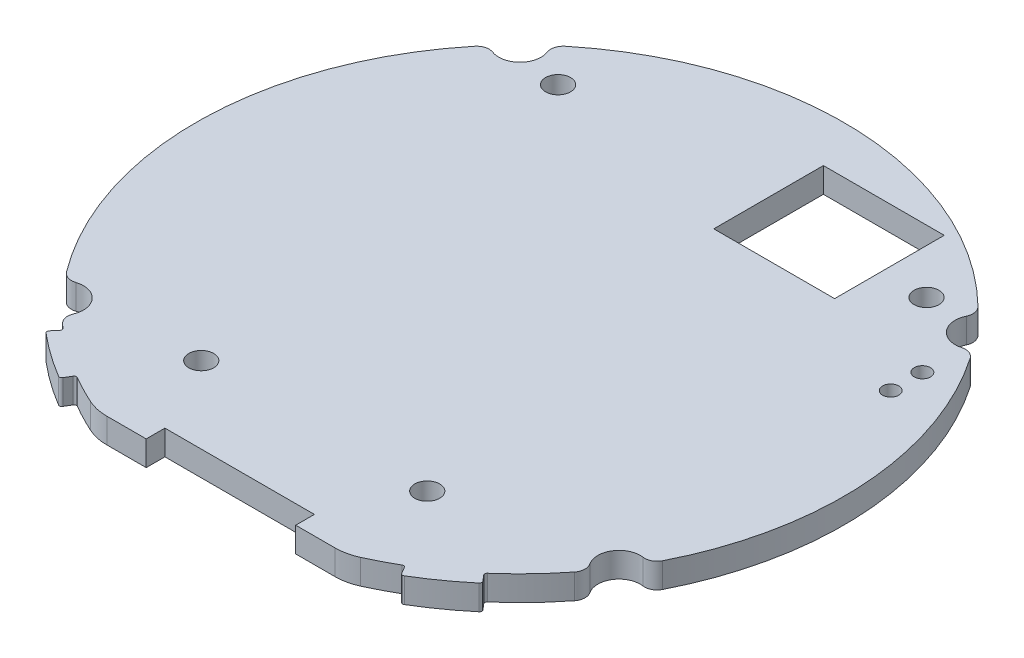
from build123d import *

# Parameters (mm, degrees)
SKETCH1_R               = 13
BOSS_EXTRUDE1_DEPTH     = 1
CUT_EXTRUDE2_DEPTH      = 1
FILLET1_R               = 2
SKETCH4_R               = 0.5
CUT_EXTRUDE3_DEPTH      = 1
SKETCH6_R               = 0.85
CUT_EXTRUDE4_DEPTH      = 10
FILLET2_R               = 0.5
BOSS_EXTRUDE4_START     = -1
BOSS_EXTRUDE4_DEPTH     = 1
FILLET4_R               = 0.1
CUT_EXTRUDE6_DEPTH      = 19.411952786
CUT_EXTRUDE6_DEPTH_BACK = 19.411952786
SKETCH11_W              = 6
SKETCH11_H              = 1.5
SKETCH13_R              = 0.325
SKETCH13_W              = 4.85
SKETCH13_H              = 4.4
CUT_EXTRUDE7_DEPTH      = 1


with BuildPart() as part:
    # Sketch1 → Boss-Extrude1 (new body)
    with BuildSketch(Plane(origin=(0, 0, 0), x_dir=(1, 0, 0), z_dir=(0, 1, 0))):
        with Locations(Location((0, 0, 0), (0, 0, 270))):
            Circle(SKETCH1_R)
    extrude(amount=BOSS_EXTRUDE1_DEPTH)

    # Sketch3 → Cut-Extrude2 (cut)
    with BuildSketch(Plane(origin=(0, 0, 0), x_dir=(1, 0, 0), z_dir=(0, 1, 0))):
        with BuildLine():
            Line((-5, -12), (5, -12))
            ThreePointArc((5, -12), (0, -13), (-5, -12))
        make_face()
    extrude(amount=CUT_EXTRUDE2_DEPTH, mode=Mode.SUBTRACT)

    # Fillet1
    fillet1_edges = [part.edges().sort_by_distance(p)[0] for p in [
        (-5, 0.5, 12),
        (5, 0.5, 12),
    ]]
    fillet(fillet1_edges, radius=FILLET1_R)

    # Sketch4 → Cut-Extrude3 (cut)
    with BuildSketch(Plane.XZ):
        with Locations(Location((4.45412, 8.175151, 0), (0, 0, 270))):
            Circle(SKETCH4_R)
        with Locations(Location((-4.61588, 8.175151, 0), (0, 0, 270))):
            Circle(SKETCH4_R)
        with Locations(Location((-7.04588, -8.574849, 0), (0, 0, 270))):
            Circle(SKETCH4_R)
        with Locations(Location((7.74412, -8.574849, 0), (0, 0, 270))):
            Circle(SKETCH4_R)
    extrude(amount=-CUT_EXTRUDE3_DEPTH, mode=Mode.SUBTRACT)

    # Sketch6 → Cut-Extrude4 (cut)
    with BuildSketch(Plane.XZ):
        with Locations((9.958577761, -8.356238926)):
            Circle(SKETCH6_R)
        with Locations((-9.584605379, 8.782672699)):
            Circle(SKETCH6_R)
        with Locations((-9.192388155, -9.192388155)):
            Circle(SKETCH6_R)
        with Locations((10.964088796, 6.984894909)):
            Circle(SKETCH6_R)
    extrude(amount=-CUT_EXTRUDE4_DEPTH, mode=Mode.SUBTRACT)

    # Fillet2
    fillet2_edges = [part.edges().sort_by_distance(p)[0] for p in [
        (10.484191703, 0.5, 7.686463708),
        (11.397112787, 0.5, 6.25346465),
        (-10.138062294, 0.5, 8.137548337),
        (-8.990172858, 0.5, 9.390249836),
        (-8.57201926, 0.5, -9.773458232),
        (-9.773458232, 0.5, -8.57201926),
        (10.483367978, 0.5, -7.687587127),
        (9.39121315, 0.5, -8.989166567),
    ]]
    fillet(fillet2_edges, radius=FILLET2_R)

    # Sketch10 → Boss-Extrude4 (add)
    with BuildSketch(Plane(origin=(0, 1, 0), x_dir=(1, 0, 0), z_dir=(0, 1, 0)).offset(BOSS_EXTRUDE4_START)):
        with BuildLine():
            Line((-6.597998718, -11.201179086), (-6.8517679, -11.631993666))
            ThreePointArc((-6.8517679, -11.631993666), (-7.839489902, -10.990559498), (-8.767548652, -10.265480536))
            Line((-8.767548652, -10.265480536), (-8.442824628, -9.885277553))
            ThreePointArc((-8.442824628, -9.885277553), (-7.549138424, -10.583501739), (-6.597998718, -11.201179086))
        make_face()
        with BuildLine():
            Line((8.442824628, -9.885277553), (8.767548652, -10.265480536))
            ThreePointArc((8.767548652, -10.265480536), (7.839489902, -10.990559498), (6.8517679, -11.631993666))
            Line((6.8517679, -11.631993666), (6.597998718, -11.201179086))
            ThreePointArc((6.597998718, -11.201179086), (7.549138424, -10.583501739), (8.442824628, -9.885277553))
        make_face()
    extrude(amount=BOSS_EXTRUDE4_DEPTH)

    # Fillet4
    fillet4_edges = [part.edges().sort_by_distance(p)[0] for p in [
        (-8.442824628, 0.5, 9.885277553),
        (-6.597998718, 0.5, 11.201179086),
        (-6.8517679, 0.5, 11.631993666),
        (-8.767548652, 0.5, 10.265480536),
        (6.597998718, 0.5, 11.201179086),
        (8.442824628, 0.5, 9.885277553),
        (8.767548652, 0.5, 10.265480536),
        (6.8517679, 0.5, 11.631993666),
    ]]
    fillet(fillet4_edges, radius=FILLET4_R)

    # Sketch11 → Cut-Extrude6 (cut, two sides: drawn at the far end of the back side and taken through both)
    with BuildSketch(Plane(origin=(0, 0, 0), x_dir=(1, 0, 0), z_dir=(0, 1, 0)).offset(-CUT_EXTRUDE6_DEPTH_BACK)):
        with Locations((0, -12)):
            Rectangle(SKETCH11_W, SKETCH11_H)
    extrude(amount=CUT_EXTRUDE6_DEPTH + CUT_EXTRUDE6_DEPTH_BACK, mode=Mode.SUBTRACT)

    # Sketch13 → Cut-Extrude7 (cut)
    with BuildSketch(Plane(origin=(0, 1, 0), x_dir=(1, 0, 0), z_dir=(0, 1, 0))):
        with Locations(Location((10.26011, 4.62025, 0), (0, 0, 270))):
            Circle(SKETCH13_R)
        with Locations(Location((10.26011, 5.89025, 0), (0, 0, 270))):
            Circle(SKETCH13_R)
        with Locations((3.51412, 8.889849)):
            Rectangle(SKETCH13_W, SKETCH13_H)
    extrude(amount=-CUT_EXTRUDE7_DEPTH, mode=Mode.SUBTRACT)


solid = part.part
